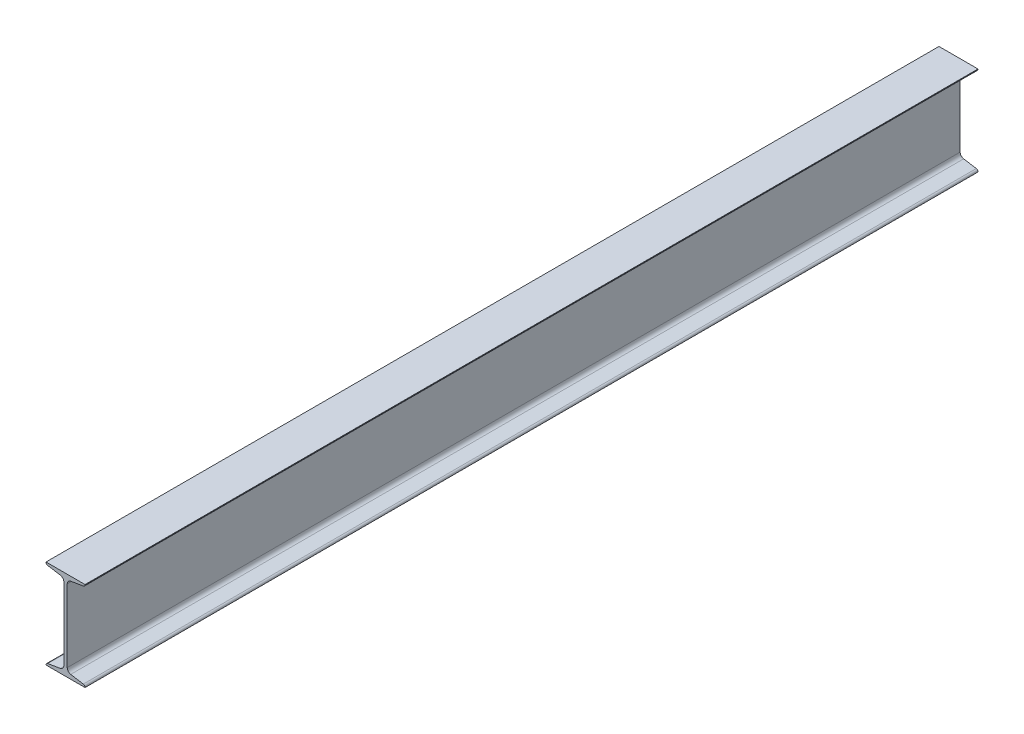
from build123d import *

# Parameters (mm, degrees)
EXTRUDE1_DEPTH = 3050


with BuildPart() as part:
    # Sketch1 → Extrude1 (new body)
    with BuildSketch(Plane.XY):
        with BuildLine():
            Line((-66.675, -152.4), (-66.675, -152.03634552))
            ThreePointArc((-66.675, -152.03634552), (-64.989504955, -147.439217289), (-60.731921268, -145.021064551))
            Line((-60.731921268, -145.021064551), (-17.728157464, -137.855561937))
            ThreePointArc((-17.728157464, -137.855561937), (-9.212990089, -133.019256462), (-5.842, -123.825))
            Line((-5.842, -123.825), (-5.842, 123.825))
            ThreePointArc((-5.842, 123.825), (-9.212990089, 133.019256462), (-17.728157464, 137.855561937))
            Line((-17.728157464, 137.855561937), (-60.731921268, 145.021064551))
            ThreePointArc((-60.731921268, 145.021064551), (-64.989504955, 147.439217289), (-66.675, 152.03634552))
            Line((-66.675, 152.03634552), (-66.675, 152.4))
            Line((-66.675, 152.4), (66.675, 152.4))
            Line((66.675, 152.4), (66.675, 152.03634552))
            ThreePointArc((66.675, 152.03634552), (64.989504955, 147.439217289), (60.731921268, 145.021064551))
            Line((60.731921268, 145.021064551), (17.728157464, 137.855561937))
            ThreePointArc((17.728157464, 137.855561937), (9.212990089, 133.019256462), (5.842, 123.825))
            Line((5.842, 123.825), (5.842, -123.825))
            ThreePointArc((5.842, -123.825), (9.212990089, -133.019256462), (17.728157464, -137.855561937))
            Line((17.728157464, -137.855561937), (60.731921268, -145.021064551))
            ThreePointArc((60.731921268, -145.021064551), (64.989504955, -147.439217289), (66.675, -152.03634552))
            Line((66.675, -152.03634552), (66.675, -152.4))
            Line((66.675, -152.4), (-66.675, -152.4))
        make_face()
    extrude(amount=EXTRUDE1_DEPTH)


solid = part.part
